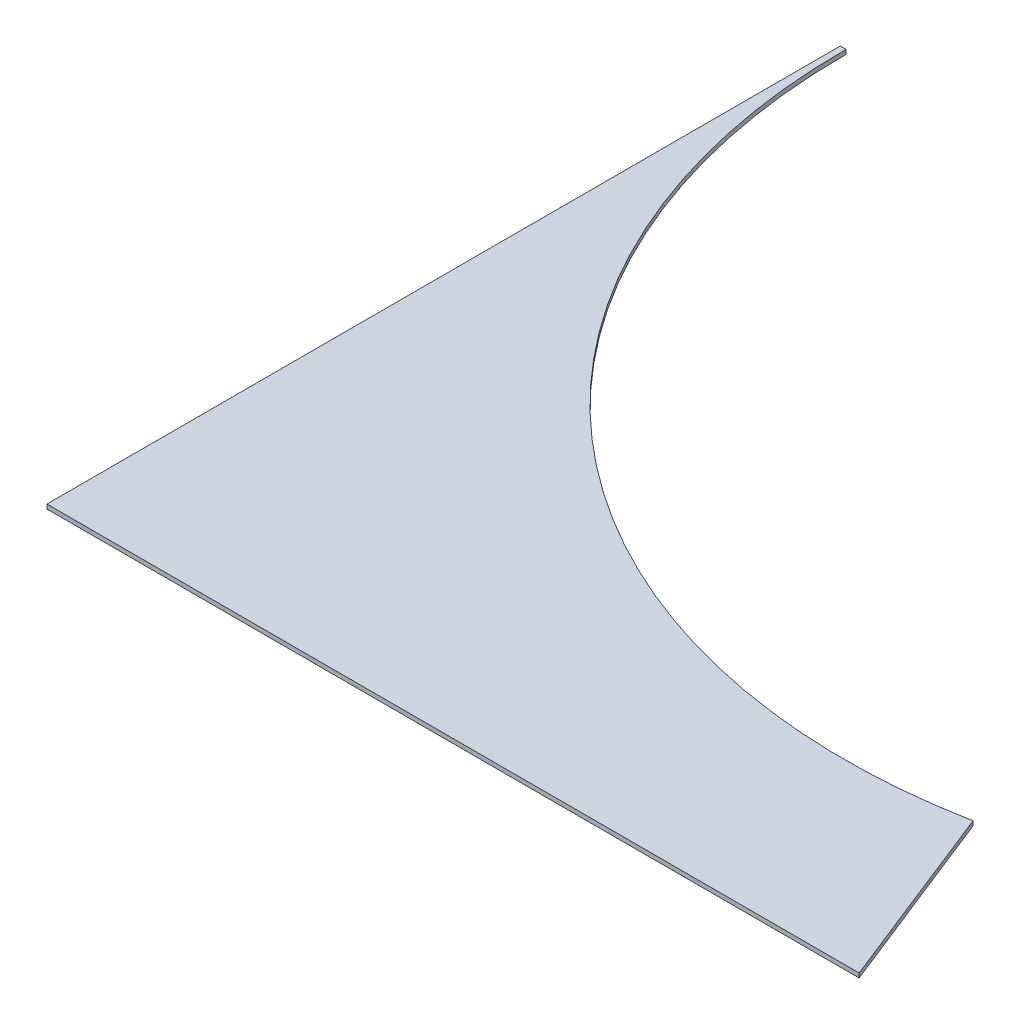
from build123d import *

# Parameters (mm, degrees)
BOSS_EXTRUDE1_DEPTH = 3


with BuildPart() as part:
    # Sketch1 → Boss-Extrude1 (new body)
    with BuildSketch(Plane(origin=(0, 0, 0), x_dir=(1, 0, 0), z_dir=(0, 1, 0))):
        with BuildLine():
            Line((281, -416.839959599), (332.596230099, -546.985374576))
            Line((332.596230099, -546.985374576), (-227.403769901, -546.985374576))
            Line((-227.403769901, -546.985374576), (-227.403769901, 0))
            Line((-227.403769901, 0), (-223.403769901, 0))
            ThreePointArc((-223.403769901, 0), (-69.685597195, -327.59174965), (281, -416.839959599))
        make_face()
    extrude(amount=BOSS_EXTRUDE1_DEPTH)


solid = part.part
